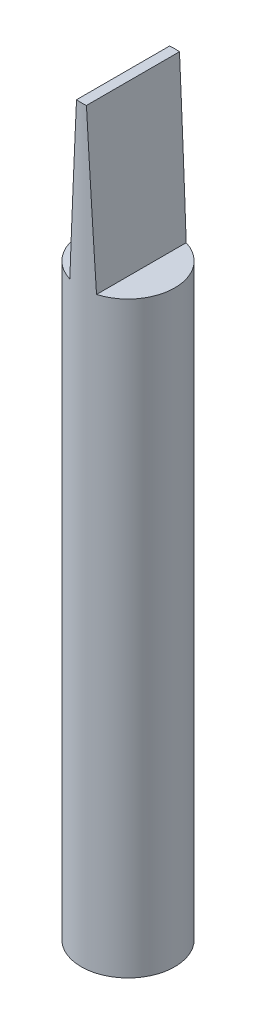
from build123d import *

# Parameters (mm, degrees)
SKETCH2_R               = 1.75
BOSS_EXTRUDE2_DEPTH     = 28
CUT_EXTRUDE1_START      = -6
CUT_EXTRUDE1_DEPTH      = 6
CUT_EXTRUDE2_DEPTH      = 29.263177076
CUT_EXTRUDE2_DEPTH_BACK = 29.263177076


with BuildPart() as part:
    # Sketch2 → Boss-Extrude2 (new body)
    with BuildSketch(Plane(origin=(0, 0, 0), x_dir=(1, 0, 0), z_dir=(0, 1, 0))):
        with Locations(Location((0, 0, 0), (0, 0, 270))):
            Circle(SKETCH2_R)
    extrude(amount=BOSS_EXTRUDE2_DEPTH)

    # Sketch5 → Cut-Extrude1 (cut)
    with BuildSketch(Plane(origin=(0, 28, 0), x_dir=(1, 0, 0), z_dir=(0, 1, 0)).offset(CUT_EXTRUDE1_START)):
        with BuildLine():
            Line((0.5, 1.677050983), (0.5, -1.677050983))
            ThreePointArc((0.5, -1.677050983), (1.75, 0), (0.5, 1.677050983))
        make_face()
        with BuildLine():
            Line((-0.5, -1.677050983), (-0.5, 1.677050983))
            ThreePointArc((-0.5, 1.677050983), (-1.75, 0), (-0.5, -1.677050983))
        make_face()
    extrude(amount=CUT_EXTRUDE1_DEPTH, mode=Mode.SUBTRACT)

    # Sketch9 → Cut-Extrude2 (cut, two sides: drawn at the far end of the back side and taken through both)
    with BuildSketch(Plane(origin=(0, 0, 1.677050983), x_dir=(-1, 0, 0), z_dir=(0, 0, -1)).offset(-CUT_EXTRUDE2_DEPTH_BACK)):
        Polygon((0.5, 22), (0.5, 28), (0.185553324, 28), align=None)
        Polygon((-0.5, 22), (-0.5, 28), (-0.185553324, 28), align=None)
    extrude(amount=CUT_EXTRUDE2_DEPTH + CUT_EXTRUDE2_DEPTH_BACK, mode=Mode.SUBTRACT)


solid = part.part
